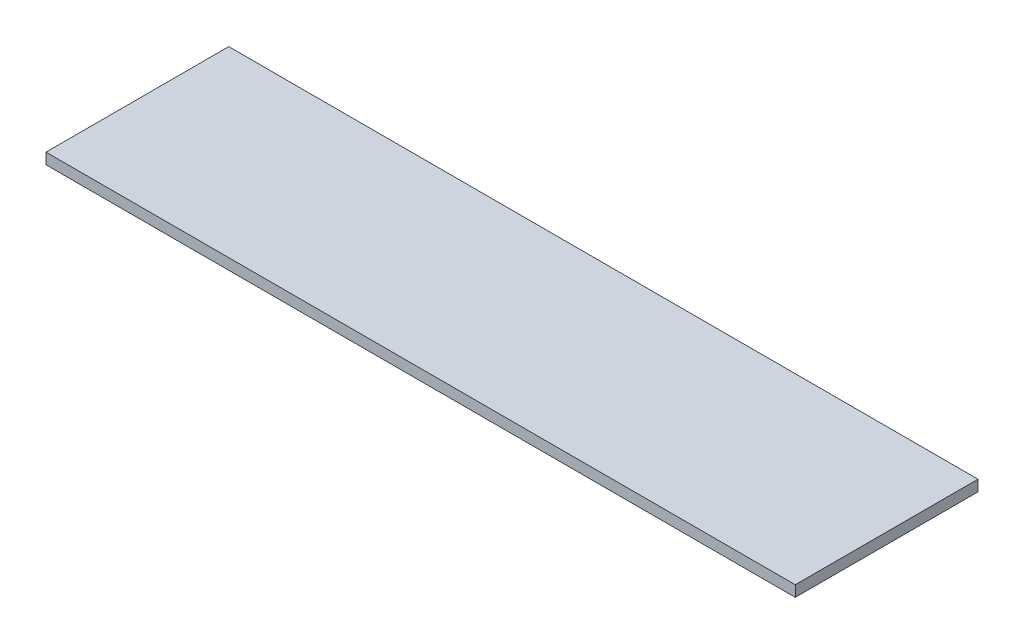
from build123d import *

# Parameters (mm, degrees)
ESBO_O2_W                = 120
ESBO_O2_H                = 100
RESSALTO_EXTRUS_O1_DEPTH = 6
ESBO_O3_W                = 100
ESBO_O3_H                = 6
RESSALTO_EXTRUS_O3_DEPTH = 70
ESBO_O4_W                = 100
ESBO_O4_H                = 6
RESSALTO_EXTRUS_O4_DEPTH = 120
ESBO_O5_W                = 100
ESBO_O5_H                = 6
RESSALTO_EXTRUS_O5_DEPTH = 100


with BuildPart() as part:
    # Esboço2 → Ressalto-extrusão1 (new body)
    with BuildSketch(Plane(origin=(0, 0, 0), x_dir=(1, 0, 0), z_dir=(0, 1, 0))):
        with Locations((60, 50)):
            Rectangle(ESBO_O2_W, ESBO_O2_H)
    extrude(amount=RESSALTO_EXTRUS_O1_DEPTH)

    # Esboço3 → Ressalto-extrusão3 (add)
    with BuildSketch(Plane.ZY):
        with Locations((-50, 3)):
            Rectangle(ESBO_O3_W, ESBO_O3_H)
    extrude(amount=RESSALTO_EXTRUS_O3_DEPTH)

    # Esboço4 → Ressalto-extrusão4 (add)
    with BuildSketch(Plane(origin=(120, 0, 0), x_dir=(0, 0, -1), z_dir=(1, 0, 0))):
        with Locations((50, 3)):
            Rectangle(ESBO_O4_W, ESBO_O4_H)
    extrude(amount=RESSALTO_EXTRUS_O4_DEPTH)

    # Esboço5 → Ressalto-extrusão5 (add)
    with BuildSketch(Plane(origin=(240, 0, 0), x_dir=(0, 0, -1), z_dir=(1, 0, 0))):
        with Locations((50, 3)):
            Rectangle(ESBO_O5_W, ESBO_O5_H)
    extrude(amount=RESSALTO_EXTRUS_O5_DEPTH)


solid = part.part
